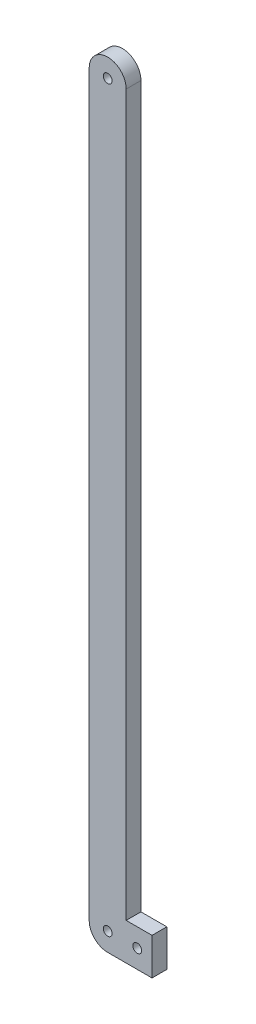
from build123d import *

# Parameters (mm, degrees)
SKETCH1_R           = 3
BOSS_EXTRUDE1_DEPTH = 10


with BuildPart() as part:
    # Sketch1 → Boss-Extrude1 (new body)
    with BuildSketch(Plane.XY):
        with BuildLine():
            Line((-12.5, 0), (-12.5, -499.599839872))
            ThreePointArc((-12.5, -499.599839872), (-8.838834765, -508.438674637), (0, -512.099839872))
            Line((0, -512.099839872), (30, -512.099839872))
            Line((30, -512.099839872), (30, -487.099839872))
            Line((30, -487.099839872), (12.5, -487.099839872))
            Line((12.5, -487.099839872), (12.5, 0))
            ThreePointArc((12.5, 0), (0, 12.5), (-12.5, 0))
        make_face()
        Circle(SKETCH1_R, mode=Mode.SUBTRACT)
        with Locations(Location((0, -499.599839872, 0), (0, 0, 180))):
            Circle(SKETCH1_R, mode=Mode.SUBTRACT)
        with Locations((20, -499.599839872)):
            Circle(SKETCH1_R, mode=Mode.SUBTRACT)
    extrude(amount=BOSS_EXTRUDE1_DEPTH)


solid = part.part
